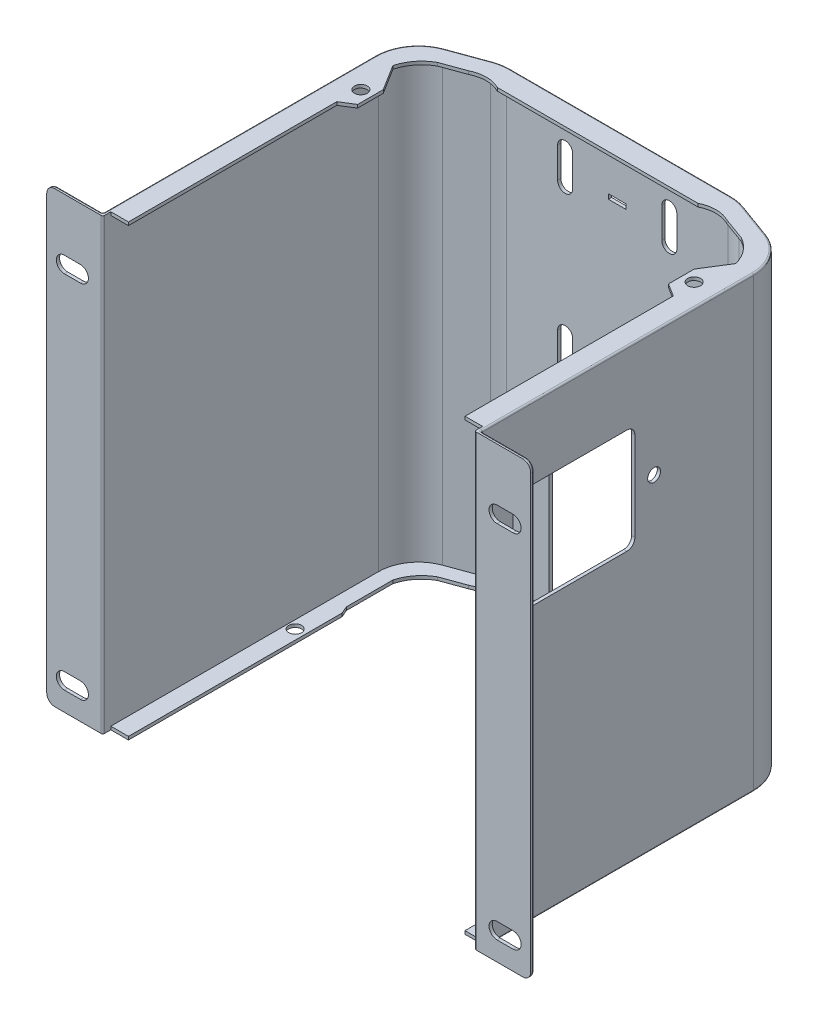
from build123d import *

# Parameters (mm, degrees)
BOSS_EXTRUDE1_DEPTH = 280
FILLET1_R           = 5
BOSS_EXTRUDE2_START = -2
SKETCH2_R           = 4
BOSS_EXTRUDE2_DEPTH = 2
SKETCH3_R           = 4
BOSS_EXTRUDE3_DEPTH = 2
FILLET3_R           = 1
CUT_EXTRUDE3_DEPTH  = 2
CUT_EXTRUDE4_DEPTH  = 382.556024761
SKETCH8_W           = 11
SKETCH8_H           = 3
CUT_EXTRUDE5_DEPTH  = 2
SKETCH9_R           = 4
SKETCH9_W           = 76
SKETCH9_H           = 65.5
CUT_EXTRUDE6_DEPTH  = 2
FILLET4_R           = 5


with BuildPart() as part:
    # Sketch1 → Boss-Extrude1 (new body)
    with BuildSketch(Plane(origin=(0, 0, 0), x_dir=(1, 0, 0), z_dir=(0, 1, 0))):
        with BuildLine():
            Line((-72.523963969, 103.49231552), (-94.550503583, 95.475310736))
            ThreePointArc((-94.550503583, 95.475310736), (-106.478801107, 86.322406125), (-111, 71.982995217))
            Line((-111, 71.982995217), (-111, -99))
            ThreePointArc((-111, -99), (-111.292893219, -99.707106781), (-112, -100))
            Line((-112, -100), (-146, -100))
            Line((-146, -100), (-146, -98))
            Line((-146, -98), (-114, -98))
            ThreePointArc((-114, -98), (-113.292893219, -97.707106781), (-113, -97))
            Line((-113, -97), (-113, 71.982995217))
            ThreePointArc((-113, 71.982995217), (-108.117105196, 87.469558998), (-95.23454387, 97.354695978))
            Line((-95.23454387, 97.354695978), (-73.208004256, 105.371700761))
            ThreePointArc((-73.208004256, 105.371700761), (-68.661961183, 106.589809331), (-63.973460386, 107))
            Line((-63.973460386, 107), (73.973460386, 107))
            ThreePointArc((73.973460386, 107), (78.661961183, 106.589809331), (83.208004256, 105.371700761))
            Line((83.208004256, 105.371700761), (105.23454387, 97.354695978))
            ThreePointArc((105.23454387, 97.354695978), (118.117105196, 87.469558998), (123, 71.982995217))
            Line((123, 71.982995217), (123, -97))
            ThreePointArc((123, -97), (123.292893219, -97.707106781), (124, -98))
            Line((124, -98), (156, -98))
            Line((156, -98), (156, -100))
            Line((156, -100), (122, -100))
            ThreePointArc((122, -100), (121.292893219, -99.707106781), (121, -99))
            Line((121, -99), (121, 71.982995217))
            ThreePointArc((121, 71.982995217), (116.478801107, 86.322406125), (104.550503583, 95.475310736))
            Line((104.550503583, 95.475310736), (82.523963969, 103.49231552))
            ThreePointArc((82.523963969, 103.49231552), (78.314664828, 104.620193825), (73.973460386, 105))
            Line((73.973460386, 105), (-63.973460386, 105))
            ThreePointArc((-63.973460386, 105), (-68.314664828, 104.620193825), (-72.523963969, 103.49231552))
        make_face()
    extrude(amount=-BOSS_EXTRUDE1_DEPTH)

    # Fillet1
    fillet1_edges = [part.edges().sort_by_distance(p)[0] for p in [
        (156, -280, 99),
        (-146, 0, 99),
        (156, 0, 99),
        (-146, -280, 99),
    ]]
    fillet(fillet1_edges, radius=FILLET1_R)

    # Sketch2 → Boss-Extrude2 (add)
    # profile 1 of 2: a face of its own
    with BuildSketch(Plane.XZ.offset(280).offset(BOSS_EXTRUDE2_START)):
        with BuildLine():
            Line((67.597643231, -92.77042809), (5, -92.77042809))
            Line((5, -92.77042809), (5, -105))
            Line((5, -105), (73.973460386, -105))
            ThreePointArc((73.973460386, -105), (78.314664828, -104.620193825), (82.523963969, -103.49231552))
            Line((82.523963969, -103.49231552), (104.550503583, -95.475310736))
            ThreePointArc((104.550503583, -95.475310736), (116.478801107, -86.322406125), (121, -71.982995217))
            Line((121, -71.982995217), (121, 95))
            Line((121, 95), (110, 95))
            Line((110, 95), (110, -38.349628832))
            Line((110, -38.349628832), (112, -42.982995217))
            Line((112, -42.982995217), (112, -47.982995217))
            Line((112, -47.982995217), (112, -55.982995217))
            Line((112, -55.982995217), (112, -71.982995217))
            ThreePointArc((112, -71.982995217), (107.504117432, -81.079607593), (99.763257285, -87.64012594))
            Line((99.763257285, -87.64012594), (85.667867974, -92.77042809))
            ThreePointArc((85.667867974, -92.77042809), (76.632755602, -94.92759355), (67.597643231, -92.77042809))
        make_face()
        with Locations(Location((116, -15, 0), (0, 0, 270))):
            Circle(SKETCH2_R, mode=Mode.SUBTRACT)
    # profile 2 of 2: a face of its own
    with BuildSketch(Plane.XZ.offset(280).offset(BOSS_EXTRUDE2_START)):
        with BuildLine():
            Line((-102, -55.982995217), (-102, -47.982995217))
            Line((-102, -47.982995217), (-102, -42.982995217))
            Line((-102, -42.982995217), (-100, -38.349628832))
            Line((-100, -38.349628832), (-100, 95))
            Line((-100, 95), (-111, 95))
            Line((-111, 95), (-111, -71.982995217))
            ThreePointArc((-111, -71.982995217), (-106.478801107, -86.322406125), (-94.550503583, -95.475310736))
            Line((-94.550503583, -95.475310736), (-72.523963969, -103.49231552))
            ThreePointArc((-72.523963969, -103.49231552), (-68.314664828, -104.620193825), (-63.973460386, -105))
            Line((-63.973460386, -105), (5, -105))
            Line((5, -105), (5, -92.77042809))
            Line((5, -92.77042809), (-57.597643231, -92.77042809))
            ThreePointArc((-57.597643231, -92.77042809), (-66.632755602, -94.92759355), (-75.667867974, -92.77042809))
            Line((-75.667867974, -92.77042809), (-89.763257285, -87.64012594))
            ThreePointArc((-89.763257285, -87.64012594), (-97.504117432, -81.079607593), (-102, -71.982995217))
            Line((-102, -71.982995217), (-102, -55.982995217))
        make_face()
        with Locations(Location((-106, -15, 0), (0, 0, 270))):
            Circle(SKETCH2_R, mode=Mode.SUBTRACT)
    extrude(amount=BOSS_EXTRUDE2_DEPTH)

    # Sketch3 → Boss-Extrude3 (add)
    with BuildSketch(Plane(origin=(0, 0, 0), x_dir=(1, 0, 0), z_dir=(0, 1, 0))):
        with BuildLine():
            Line((122, -95), (110, -95))
            Line((110, -95), (110, 35))
            Line((110, 35), (102, 40))
            Line((102, 40), (102, 56))
            Line((102, 56), (112, 71.982995217))
            ThreePointArc((112, 71.982995217), (107.504117432, 81.079607593), (99.763257285, 87.64012594))
            Line((99.763257285, 87.64012594), (85.667867974, 92.77042809))
            ThreePointArc((85.667867974, 92.77042809), (76.632755602, 94.92759355), (67.597643231, 92.77042809))
            Line((67.597643231, 92.77042809), (-57.597643231, 92.77042809))
            ThreePointArc((-57.597643231, 92.77042809), (-66.632755602, 94.92759355), (-75.667867974, 92.77042809))
            Line((-75.667867974, 92.77042809), (-89.763257285, 87.64012594))
            ThreePointArc((-89.763257285, 87.64012594), (-97.504117432, 81.079607593), (-102, 71.982995217))
            Line((-102, 71.982995217), (-92, 56))
            Line((-92, 56), (-92, 40))
            Line((-92, 40), (-100, 35))
            Line((-100, 35), (-100, -95))
            Line((-100, -95), (-112, -95))
            Line((-112, -95), (-112, 71.982995217))
            ThreePointArc((-112, 71.982995217), (-107.297953152, 86.895982562), (-94.892523726, 96.415003357))
            Line((-94.892523726, 96.415003357), (-72.865984112, 104.43200814))
            ThreePointArc((-72.865984112, 104.43200814), (-68.488313005, 105.605001578), (-63.973460386, 106))
            Line((-63.973460386, 106), (73.973460386, 106))
            ThreePointArc((73.973460386, 106), (78.488313005, 105.605001578), (82.865984112, 104.43200814))
            Line((82.865984112, 104.43200814), (104.892523726, 96.415003357))
            ThreePointArc((104.892523726, 96.415003357), (117.297953152, 86.895982562), (122, 71.982995217))
            Line((122, 71.982995217), (122, -95))
        make_face()
        with Locations(Location((109, 49, 0), (0, 0, 90))):
            Circle(SKETCH3_R, mode=Mode.SUBTRACT)
        with Locations(Location((-99, 49, 0), (0, 0, 270))):
            Circle(SKETCH3_R, mode=Mode.SUBTRACT)
    extrude(amount=-BOSS_EXTRUDE3_DEPTH)

    # Fillet3
    fillet3_edges = [part.edges().sort_by_distance(p)[0] for p in [
        (123.292893219, -280, 97.707106781),
        (-127.5, 0, 98),
        (-113.292893219, 0, 97.707106781),
        (-113, 0, 12.508502392),
        (-108.117105196, 0, -87.469558998),
        (-84.221274063, 0, -101.363198369),
        (-68.661961183, 0, -106.589809331),
        (123, -280, 12.508502392),
        (5, 0, -107),
        (78.661961183, 0, -106.589809331),
        (94.221274063, 0, -101.363198369),
        (118.117105196, 0, -87.469558998),
        (123, 0, 12.508502392),
        (123.292893219, 0, 97.707106781),
        (118.117105196, -280, -87.469558998),
        (94.221274063, -280, -101.363198369),
        (78.661961183, -280, -106.589809331),
        (5, -280, -107),
        (-68.661961183, -280, -106.589809331),
        (-84.221274063, -280, -101.363198369),
        (-108.117105196, -280, -87.469558998),
        (-113, -280, 12.508502392),
        (-113.292893219, -280, 97.707106781),
        (-127.5, -280, 98),
        (137.5, 0, 98),
        (156, -140, 98),
        (137.5, -280, 98),
        (154.535533906, -278.535533906, 98),
        (154.535533906, -1.464466094, 98),
        (-146, -140, 98),
        (-144.535533906, -278.535533906, 98),
        (-144.535533906, -1.464466094, 98),
    ]]
    fillet(fillet3_edges, radius=FILLET3_R)

    # Sketch6 → Cut-Extrude3 (cut)
    with BuildSketch(Plane(origin=(0, 0, 98), x_dir=(-1, 0, 0), z_dir=(0, 0, -1))):
        with BuildLine():
            Line((125, -43), (135, -43))
            ThreePointArc((135, -43), (140, -38), (135, -33))
            Line((135, -33), (125, -33))
            ThreePointArc((125, -33), (120, -38), (125, -43))
        make_face()
        with BuildLine():
            Line((125, -268), (135, -268))
            ThreePointArc((135, -268), (140, -263), (135, -258))
            Line((135, -258), (125, -258))
            ThreePointArc((125, -258), (120, -263), (125, -268))
        make_face()
        with BuildLine():
            ThreePointArc((-145, -268), (-150, -263), (-145, -258))
            Line((-145, -258), (-135, -258))
            ThreePointArc((-135, -258), (-130, -263), (-135, -268))
            Line((-135, -268), (-145, -268))
        make_face()
        with BuildLine():
            ThreePointArc((-145, -43), (-150, -38), (-145, -33))
            Line((-145, -33), (-135, -33))
            ThreePointArc((-135, -33), (-130, -38), (-135, -43))
            Line((-135, -43), (-145, -43))
        make_face()
    extrude(amount=-CUT_EXTRUDE3_DEPTH, mode=Mode.SUBTRACT)

    # Sketch7 → Cut-Extrude4 (cut, through all)
    with BuildSketch(Plane(origin=(0, 0, -107), x_dir=(-1, 0, 0), z_dir=(0, 0, -1))):
        with BuildLine():
            Line((-32.789841132, -24.503291505), (-32.789841132, -43.568220255))
            ThreePointArc((-32.789841132, -43.568220255), (-37.5, -48.278379123), (-42.210158868, -43.568220255))
            Line((-42.210158868, -43.568220255), (-42.210158868, -24.503291505))
            ThreePointArc((-42.210158868, -24.503291505), (-37.5, -19.793132637), (-32.789841132, -24.503291505))
        make_face()
        with BuildLine():
            Line((32.210158868, -24.503291505), (32.210158868, -43.568220255))
            ThreePointArc((32.210158868, -43.568220255), (27.5, -48.278379123), (22.789841132, -43.568220255))
            Line((22.789841132, -43.568220255), (22.789841132, -24.503291505))
            ThreePointArc((22.789841132, -24.503291505), (27.5, -19.793132637), (32.210158868, -24.503291505))
        make_face()
        with BuildLine():
            Line((32.210158868, -124.503291505), (32.210158868, -143.568220255))
            ThreePointArc((32.210158868, -143.568220255), (27.5, -148.278379123), (22.789841132, -143.568220255))
            Line((22.789841132, -143.568220255), (22.789841132, -124.503291505))
            ThreePointArc((22.789841132, -124.503291505), (27.5, -119.793132637), (32.210158868, -124.503291505))
        make_face()
        with BuildLine():
            Line((-32.789841132, -124.503291505), (-32.789841132, -143.568220255))
            ThreePointArc((-32.789841132, -143.568220255), (-37.5, -148.278379123), (-42.210158868, -143.568220255))
            Line((-42.210158868, -143.568220255), (-42.210158868, -124.503291505))
            ThreePointArc((-42.210158868, -124.503291505), (-37.5, -119.793132637), (-32.789841132, -124.503291505))
        make_face()
        with BuildLine():
            Line((37.5, -376.5), (-47.5, -376.5))
            Line((-47.5, -376.5), (-47.5, -181.5))
            ThreePointArc((-47.5, -181.5), (-5, -139), (37.5, -181.5))
            Line((37.5, -181.5), (37.5, -376.5))
        make_face()
    extrude(amount=-CUT_EXTRUDE4_DEPTH, mode=Mode.SUBTRACT)

    # Sketch8 → Cut-Extrude5 (cut)
    with BuildSketch(Plane(origin=(0, 0, -107), x_dir=(-1, 0, 0), z_dir=(0, 0, -1))):
        with Locations((-5, -36.5)):
            Rectangle(SKETCH8_W, SKETCH8_H)
    extrude(amount=-CUT_EXTRUDE5_DEPTH, mode=Mode.SUBTRACT)

    # Sketch9 → Cut-Extrude6 (cut)
    with BuildSketch(Plane(origin=(123, 0, 0), x_dir=(0, 0, -1), z_dir=(1, 0, 0))):
        with Locations((10, -77.75)):
            Circle(SKETCH9_R)
        with Locations((-40, -77.75)):
            Rectangle(SKETCH9_W, SKETCH9_H)
    extrude(amount=-CUT_EXTRUDE6_DEPTH, mode=Mode.SUBTRACT)

    # Fillet4
    fillet4_edges = [part.edges().sort_by_distance(p)[0] for p in [
        (122, -110.5, 2),
        (122, -45, 2),
        (122, -45, 78),
        (122, -110.5, 78),
    ]]
    fillet(fillet4_edges, radius=FILLET4_R)


solid = part.part
